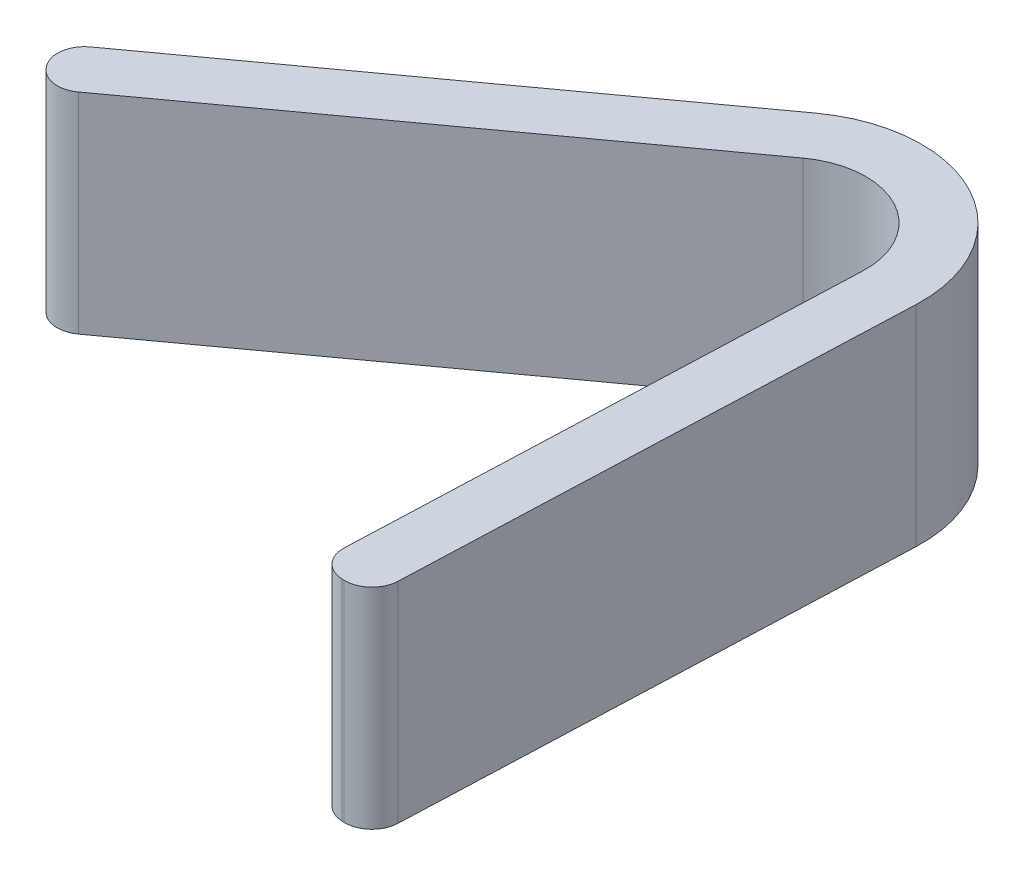
from build123d import *

# Parameters (mm, degrees)
EXTRUDE_THIN1_DEPTH = 31
FILLET1_R           = 8


with BuildPart() as part:
    # Sketch1 → Extrude-Thin1 (new, symmetric)
    with BuildSketch(Plane(origin=(0, 0, 0), x_dir=(1, 0, 0), z_dir=(0, 1, 0))):
        with BuildLine():
            Line((152.47855459256846, -515.8635684817917), (152.7896920748552, -507.8696211797939))
            Line((152.7896920748552, -507.8696211797939), (158.5314712170514, -360.34808328894457))
            ThreePointArc((158.5314712170514, -360.3480832889447), (137.27301850763482, -323.2785971562588), (94.64239044734069, -326.2278623062159))
            Line((94.64239044734076, -326.22786230621585), (-35.939394152340476, -421.1695886755354))
            Line((-35.939394152340476, -421.1695886755354), (-26.236355613015643, -434.5150389528538))
            Line((-26.236355613015643, -434.5150389528538), (104.3454289866656, -339.57331258353423))
            ThreePointArc((104.34542898666567, -339.5733125835342), (129.50014740733602, -337.8330629608887), (142.04395490668114, -359.70636223172806))
            Line((142.04395490668114, -359.7063622317282), (136.30217576448493, -507.2279001225775))
            Line((136.30217576448493, -507.2279001225775), (135.9910382821982, -515.2218474245752))
            Line((135.9910382821982, -515.2218474245752), (152.47855459256846, -515.8635684817917))
        make_face()
    extrude(amount=EXTRUDE_THIN1_DEPTH, both=True)

    # Fillet1
    fillet1_edges = [part.edges().sort_by_distance(p)[0] for p in [
        (152.47855459256846, 0, 515.8635684817917),
        (135.9910382821982, 0, 515.2218474245752),
        (-26.236355613015643, 0, 434.5150389528538),
        (-35.939394152340476, 0, 421.1695886755354),
    ]]
    fillet(fillet1_edges, radius=FILLET1_R)


solid = part.part
